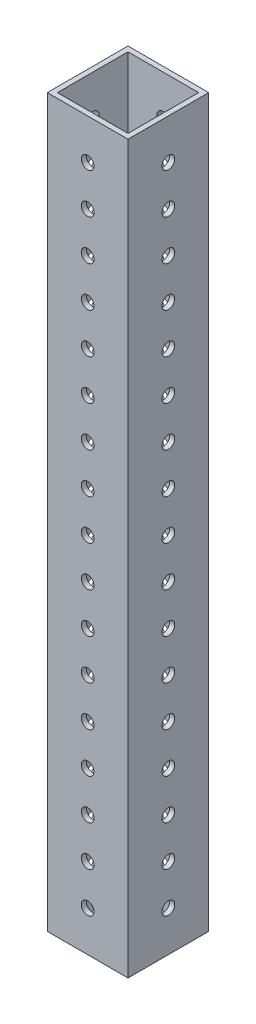
from build123d import *

# Parameters (mm, degrees)
SKETCH1_W                   = 25.4
SKETCH1_H                   = 25.4
SKETCH1_W_2                 = 22.225
SKETCH1_H_2                 = 22.225
BOSS_EXTRUDE1_DEPTH         = 228.6
F_22_0_157_DIAMETER_HOLE1_D = 3.9878
LPATTERN1_COUNT             = 17
LPATTERN1_PITCH             = 12.7
F_22_0_157_DIAMETER_HOLE2_D = 3.9878
LPATTERN2_COUNT             = 17
LPATTERN2_PITCH             = 12.7


with BuildPart() as part:
    # Sketch1 → Boss-Extrude1 (new body)
    with BuildSketch(Plane(origin=(0, 0, 0), x_dir=(1, 0, 0), z_dir=(0, 1, 0))):
        Rectangle(SKETCH1_W, SKETCH1_H)
        Rectangle(SKETCH1_W_2, SKETCH1_H_2, mode=Mode.SUBTRACT)
    extrude(amount=BOSS_EXTRUDE1_DEPTH)

    # #22 (0.157) Diameter Hole1 (through all)
    with Locations(Plane.XY.offset(12.7)):
        with Locations((0, 12.7)):
            f_22_0_157_diameter_hole1 = Hole(F_22_0_157_DIAMETER_HOLE1_D / 2)

    # LPattern1: #22 (0.157) Diameter Hole1 ×17
    with Locations(*[(0, i * LPATTERN1_PITCH, 0) for i in range(1, LPATTERN1_COUNT)]):
        add(f_22_0_157_diameter_hole1, mode=Mode.SUBTRACT)

    # #22 (0.157) Diameter Hole2 (through all)
    with Locations(Plane(origin=(12.7, 0, 0), x_dir=(0, 0, -1), z_dir=(1, 0, 0))):
        with Locations((0, 12.7)):
            f_22_0_157_diameter_hole2 = Hole(F_22_0_157_DIAMETER_HOLE2_D / 2)

    # LPattern2: #22 (0.157) Diameter Hole2 ×17
    with Locations(*[(0, i * LPATTERN2_PITCH, 0) for i in range(1, LPATTERN2_COUNT)]):
        add(f_22_0_157_diameter_hole2, mode=Mode.SUBTRACT)


solid = part.part
